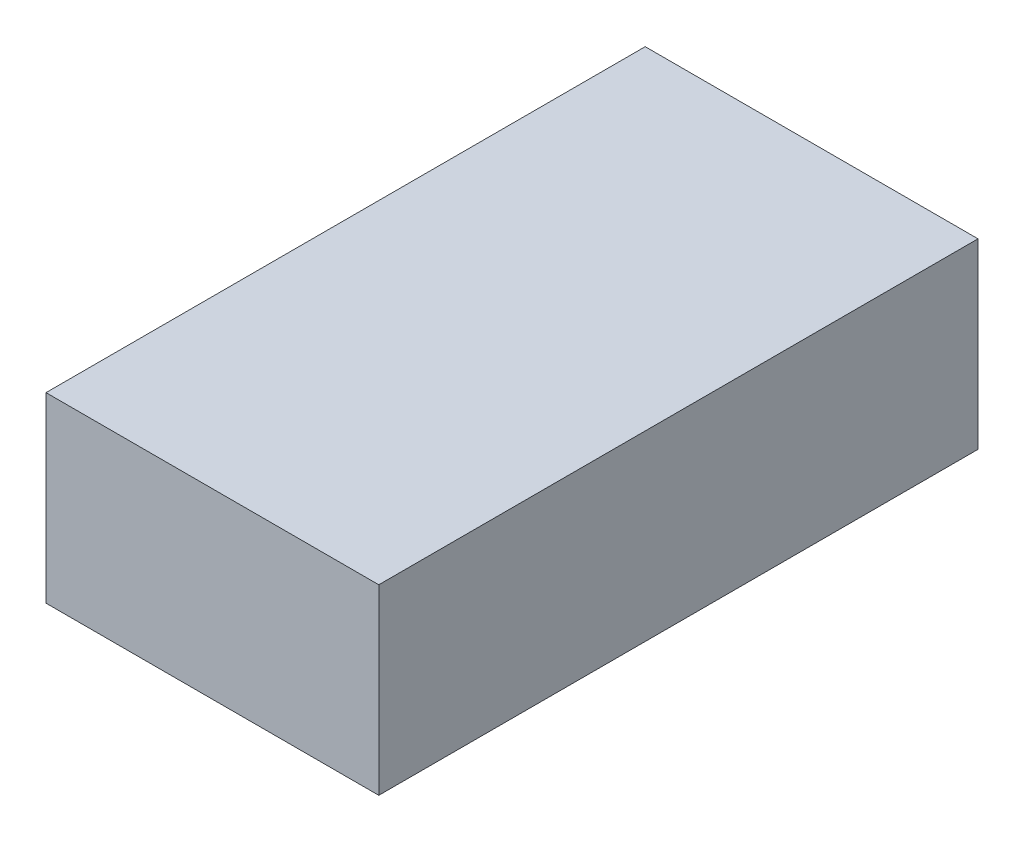
from build123d import *

# Parameters (mm, degrees)
CURVESKETCH_W   = 31.719
CURVESKETCH_H   = 17.381
CURVEBOSS_DEPTH = 57.113


with BuildPart() as part:
    # CurveSketch → CurveBoss (new body)
    with BuildSketch(Plane.XY):
        with Locations((-4.193, 6.827)):
            Rectangle(CURVESKETCH_W, CURVESKETCH_H)
    extrude(amount=-CURVEBOSS_DEPTH)


solid = part.part
